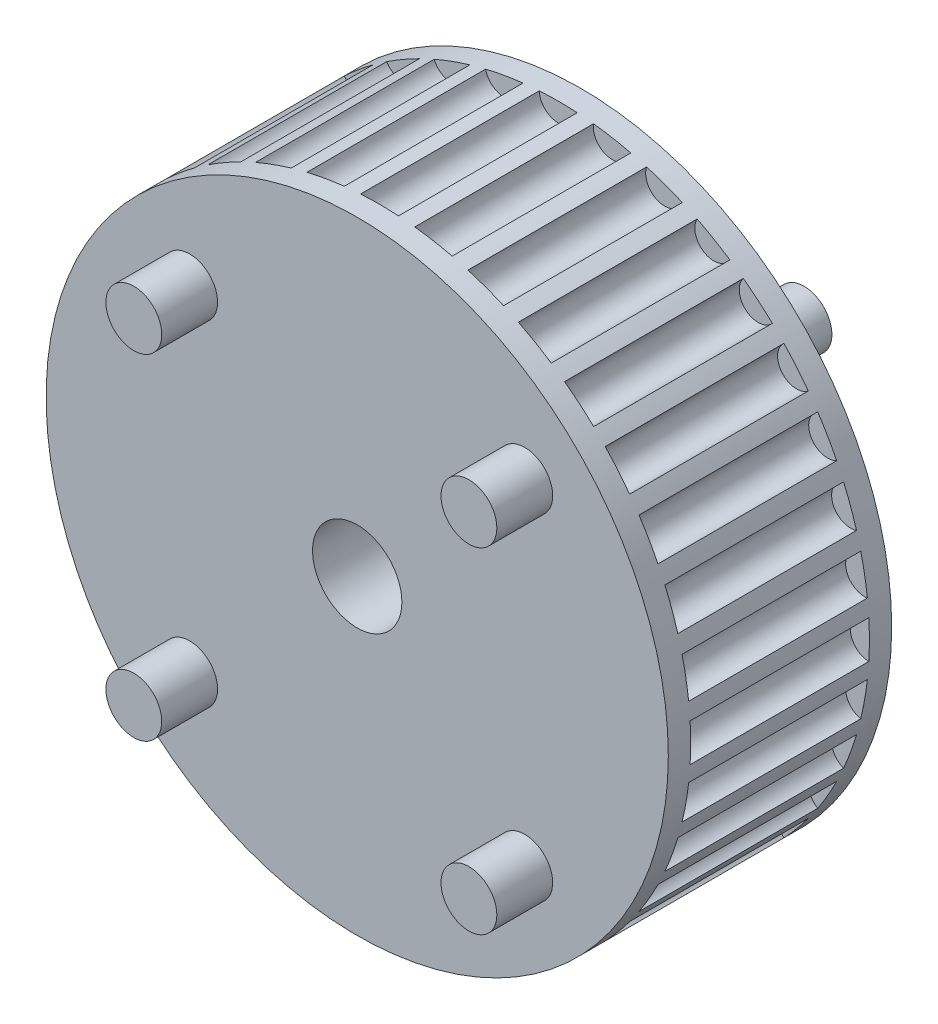
from build123d import *

# Parameters (mm, degrees)
SKETCH1_R                = 27.852115
SKETCH1_R_2              = 4
BOSS_EXTRUDE1_DEPTH      = 20
BOSS_EXTRUDE2_DEPTH      = 15
BOSS_EXTRUDE2_DEPTH_BACK = 15
SKETCH2_R                = 2.5
SKETCH4_R                = 1.7
CUT_EXTRUDE1_DEPTH       = 8


with BuildPart() as part:
    # Sketch1 → Boss-Extrude1 (new body)
    with BuildSketch(Plane.XY):
        Circle(SKETCH1_R)
        Circle(SKETCH1_R_2, mode=Mode.SUBTRACT)
    extrude(amount=BOSS_EXTRUDE1_DEPTH)

    # Sketch2 → Boss-Extrude2 (add, two sides: drawn at the far end of the back side and taken through both)
    with BuildSketch(Plane.XY.offset(10).offset(-BOSS_EXTRUDE2_DEPTH_BACK)):
        with Locations((-15, 15)):
            Circle(SKETCH2_R)
        with Locations((15, 15)):
            Circle(SKETCH2_R)
        with Locations((15, -15)):
            Circle(SKETCH2_R)
        with Locations((-15, -15)):
            Circle(SKETCH2_R)
    extrude(amount=BOSS_EXTRUDE2_DEPTH + BOSS_EXTRUDE2_DEPTH_BACK)

    # Sketch4 → Cut-Extrude1 (cut, symmetric)
    with BuildSketch(Plane.XY.offset(10)):
        with Locations((27.852115, 0)):
            Circle(SKETCH4_R)
        with Locations((27.42897879, -4.836469014)):
            Circle(SKETCH4_R)
        with Locations((26.172426939, -9.525984364)):
            Circle(SKETCH4_R)
        with Locations((24.120639139, -13.9260575)):
            Circle(SKETCH4_R)
        with Locations((21.335957925, -17.902994426)):
            Circle(SKETCH4_R)
        with Locations((17.902994426, -21.335957925)):
            Circle(SKETCH4_R)
        with Locations((13.9260575, -24.120639139)):
            Circle(SKETCH4_R)
        with Locations((9.525984364, -26.172426939)):
            Circle(SKETCH4_R)
        with Locations((4.836469014, -27.42897879)):
            Circle(SKETCH4_R)
        with Locations((0, -27.852115)):
            Circle(SKETCH4_R)
        with Locations((-4.836469014, -27.42897879)):
            Circle(SKETCH4_R)
        with Locations((-9.525984364, -26.172426939)):
            Circle(SKETCH4_R)
        with Locations((-13.9260575, -24.120639139)):
            Circle(SKETCH4_R)
        with Locations((-17.902994426, -21.335957925)):
            Circle(SKETCH4_R)
        with Locations((-21.335957925, -17.902994426)):
            Circle(SKETCH4_R)
        with Locations((-24.120639139, -13.9260575)):
            Circle(SKETCH4_R)
        with Locations((-26.172426939, -9.525984364)):
            Circle(SKETCH4_R)
        with Locations((-27.42897879, -4.836469014)):
            Circle(SKETCH4_R)
        with Locations((-27.852115, 0)):
            Circle(SKETCH4_R)
        with Locations((-27.42897879, 4.836469014)):
            Circle(SKETCH4_R)
        with Locations((-26.172426939, 9.525984364)):
            Circle(SKETCH4_R)
        with Locations((-24.120639139, 13.9260575)):
            Circle(SKETCH4_R)
        with Locations((-21.335957925, 17.902994426)):
            Circle(SKETCH4_R)
        with Locations((-17.902994426, 21.335957925)):
            Circle(SKETCH4_R)
        with Locations((-13.9260575, 24.120639139)):
            Circle(SKETCH4_R)
        with Locations((-9.525984364, 26.172426939)):
            Circle(SKETCH4_R)
        with Locations((-4.836469014, 27.42897879)):
            Circle(SKETCH4_R)
        with Locations((0, 27.852115)):
            Circle(SKETCH4_R)
        with Locations((4.836469014, 27.42897879)):
            Circle(SKETCH4_R)
        with Locations((9.525984364, 26.172426939)):
            Circle(SKETCH4_R)
        with Locations((13.9260575, 24.120639139)):
            Circle(SKETCH4_R)
        with Locations((17.902994426, 21.335957925)):
            Circle(SKETCH4_R)
        with Locations((21.335957925, 17.902994426)):
            Circle(SKETCH4_R)
        with Locations((24.120639139, 13.9260575)):
            Circle(SKETCH4_R)
        with Locations((26.172426939, 9.525984364)):
            Circle(SKETCH4_R)
        with Locations((27.42897879, 4.836469014)):
            Circle(SKETCH4_R)
    extrude(amount=CUT_EXTRUDE1_DEPTH, both=True, mode=Mode.SUBTRACT)


solid = part.part
